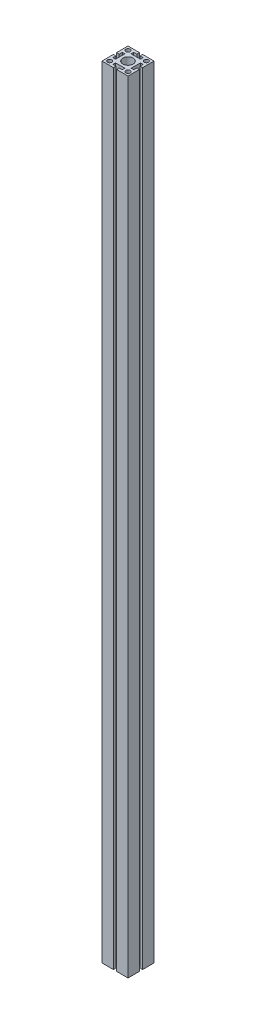
from build123d import *

# Parameters (mm, degrees)
SKETCH1_R           = 10
SKETCH1_R_2         = 4.138691164
BOSS_EXTRUDE1_DEPTH = 1500


with BuildPart() as part:
    # Sketch1 → Boss-Extrude1 (new body)
    with BuildSketch(Plane(origin=(0, 0, 0), x_dir=(1, 0, 0), z_dir=(0, 1, 0))):
        Polygon((-25, -3), (-25, -25), (-3, -25), (-3, -20), (-9, -20), (-9, -15), (9, -15), (9, -20), (3, -20), (3, -25), (25, -25), (25, -3), (20, -3), (20, -9), (15, -9), (15, 9), (20, 9), (20, 3), (25, 3), (25, 25), (3, 25), (3, 20), (9, 20), (9, 15), (-9, 15), (-9, 20), (-3, 20), (-3, 25), (-25, 25), (-25, 3), (-20, 3), (-20, 9), (-15, 9), (-15, -9), (-20, -9), (-20, -3), align=None)
        with Locations(Location((0, 0, 0), (0, 0, 270))):
            Circle(SKETCH1_R, mode=Mode.SUBTRACT)
        with Locations(Location((-17.67766953, 17.67766953, 0), (0, 0, 270))):
            Circle(SKETCH1_R_2, mode=Mode.SUBTRACT)
        with Locations(Location((17.67766953, 17.67766953, 0), (0, 0, 270))):
            Circle(SKETCH1_R_2, mode=Mode.SUBTRACT)
        with Locations(Location((17.67766953, -17.67766953, 0), (0, 0, 270))):
            Circle(SKETCH1_R_2, mode=Mode.SUBTRACT)
        with Locations(Location((-17.67766953, -17.67766953, 0), (0, 0, 270))):
            Circle(SKETCH1_R_2, mode=Mode.SUBTRACT)
    extrude(amount=BOSS_EXTRUDE1_DEPTH)


solid = part.part
